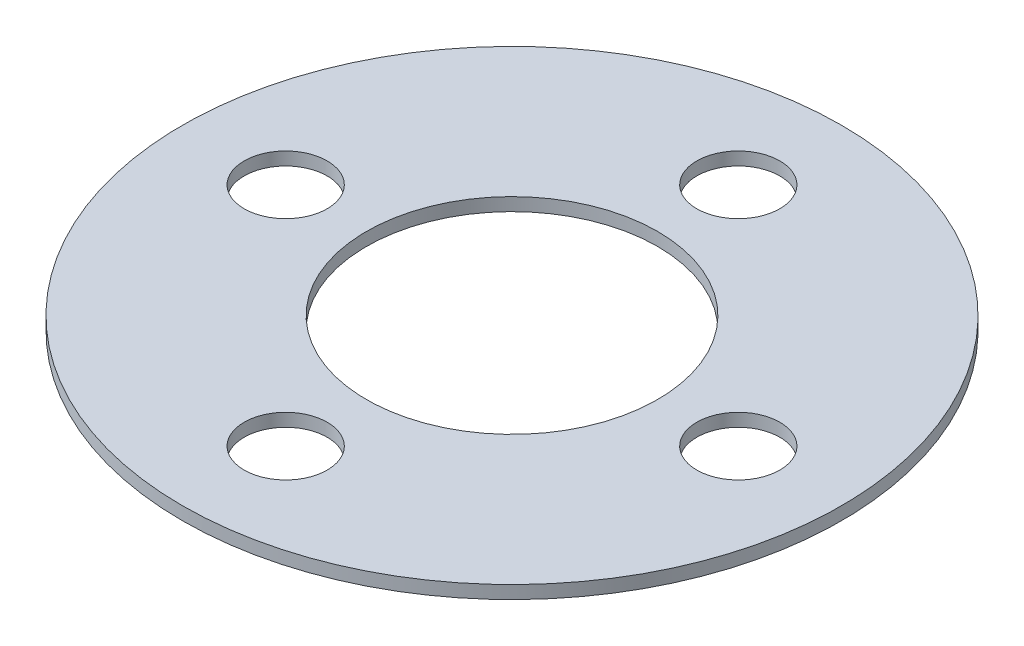
from build123d import *

# Parameters (mm, degrees)
SKETCH1_R           = 21.844
SKETCH1_R_2         = 2.75
BOSS_EXTRUDE1_DEPTH = 0.8636
SKETCH2_R           = 9.652
CUT_EXTRUDE1_DEPTH  = 0.8636


with BuildPart() as part:
    # Sketch1 → Boss-Extrude1 (new body)
    with BuildSketch(Plane(origin=(0, 0, 0), x_dir=(1, 0, 0), z_dir=(0, 1, 0))):
        with Locations(Location((0, 0, 0), (0, 0, 270))):
            Circle(SKETCH1_R)
        with Locations(Location((0, 15, 0), (0, 0, 270))):
            Circle(SKETCH1_R_2, mode=Mode.SUBTRACT)
        with Locations(Location((15, 0, 0), (0, 0, 270))):
            Circle(SKETCH1_R_2, mode=Mode.SUBTRACT)
        with Locations(Location((0, -15, 0), (0, 0, 270))):
            Circle(SKETCH1_R_2, mode=Mode.SUBTRACT)
        with Locations(Location((-15, 0, 0), (0, 0, 270))):
            Circle(SKETCH1_R_2, mode=Mode.SUBTRACT)
    extrude(amount=BOSS_EXTRUDE1_DEPTH)

    # Sketch2 → Cut-Extrude1 (cut)
    with BuildSketch(Plane.XZ):
        with Locations(Location((0, 0, 0), (0, 0, 270))):
            Circle(SKETCH2_R)
    extrude(amount=-CUT_EXTRUDE1_DEPTH, mode=Mode.SUBTRACT)


solid = part.part
